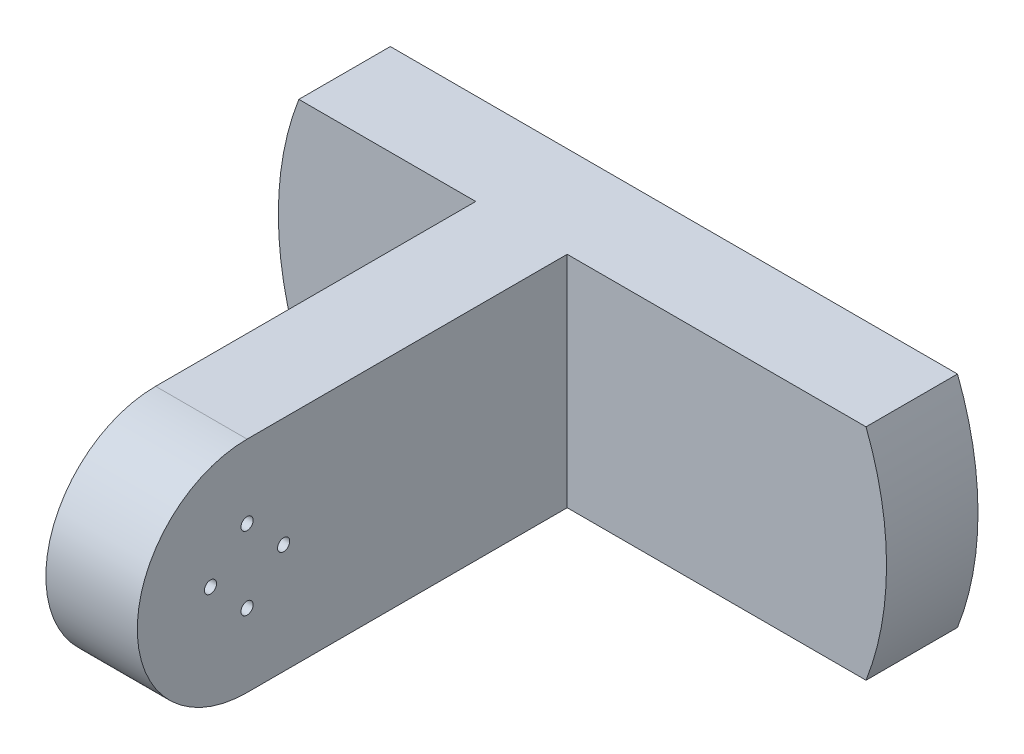
from build123d import *

# Parameters (mm, degrees)
SKETCH_2_W           = 99.74
SKETCH_2_H           = 36
EXTRUDE_1_DEPTH      = 15
SKETCH_3_R           = 1
CUT_EXTRUDE_1_DEPTH  = 5
CUT_EXTRUDE_2_REACH  = 60.24
EXTRUDE_2_DEPTH      = 7.5
EXTRUDE_2_DEPTH_BACK = 7.5
CUT_EXTRUDE_3_DEPTH  = 10
SKETCH_7_R           = 1
CUT_EXTRUDE_4_DEPTH  = 5


with BuildPart() as part:
    # 草图2 → 凸台-拉伸1 (new body)
    with BuildSketch(Plane.XY):
        with Locations((2.241740979, -3.243503904)):
            Rectangle(SKETCH_2_W, SKETCH_2_H)
    extrude(amount=EXTRUDE_1_DEPTH)

    # 草图3 → 切除-拉伸1 (cut)
    with BuildSketch(Plane.XY):
        with Locations((-40.628259021, -3.243503904)):
            Circle(SKETCH_3_R)
        with Locations((43.0931412, 9.756496096)):
            Circle(SKETCH_3_R)
        with Locations((43.0931412, -16.243503904)):
            Circle(SKETCH_3_R)
        with Locations((45.111740979, -3.243503904)):
            Circle(SKETCH_3_R)
        with Locations((-38.609659242, -16.243503904)):
            Circle(SKETCH_3_R)
        with Locations((-38.609659242, 9.756496096)):
            Circle(SKETCH_3_R)
    extrude(amount=CUT_EXTRUDE_1_DEPTH, mode=Mode.SUBTRACT)

    # 草图4 → 切除-拉伸2 (cut, up to next)
    with BuildSketch(Plane(origin=(0, 0, 0), x_dir=(-1, 0, 0), z_dir=(0, 0, -1)), mode=Mode.PRIVATE) as cut_extrude_2_sk1:
        with BuildLine():
            ThreePointArc((-52.111740979, -3.243503904), (-51.264098651, 5.912114498), (-48.749986485, 14.756496096))
            Line((-48.749986485, 14.756496096), (-52.111740979, 14.756496096))
            Line((-52.111740979, 14.756496096), (-52.111740979, -3.243503904))
        make_face()
    cut_extrude_2_tool1 = extrude(cut_extrude_2_sk1.sketch, amount=-CUT_EXTRUDE_2_REACH, mode=Mode.PRIVATE) & part.part
    # 草图4 → 切除-拉伸2 (cut, up to next)
    with BuildSketch(Plane(origin=(0, 0, 0), x_dir=(-1, 0, 0), z_dir=(0, 0, -1)), mode=Mode.PRIVATE) as cut_extrude_2_sk2:
        with BuildLine():
            Line((47.628259021, 14.756496096), (44.266504526, 14.756496096))
            ThreePointArc((44.266504526, 14.756496096), (46.780616692, 5.912114498), (47.628259021, -3.243503904))
            Line((47.628259021, -3.243503904), (47.628259021, 14.756496096))
        make_face()
    cut_extrude_2_tool2 = extrude(cut_extrude_2_sk2.sketch, amount=-CUT_EXTRUDE_2_REACH, mode=Mode.PRIVATE) & part.part
    # 草图4 → 切除-拉伸2 (cut, up to next)
    with BuildSketch(Plane(origin=(0, 0, 0), x_dir=(-1, 0, 0), z_dir=(0, 0, -1)), mode=Mode.PRIVATE) as cut_extrude_2_sk3:
        with BuildLine():
            ThreePointArc((-48.749986485, -21.243503904), (-51.264098651, -12.399122306), (-52.111740979, -3.243503904))
            Line((-52.111740979, -3.243503904), (-52.111740979, -21.243503904))
            Line((-52.111740979, -21.243503904), (-48.749986485, -21.243503904))
        make_face()
    cut_extrude_2_tool3 = extrude(cut_extrude_2_sk3.sketch, amount=-CUT_EXTRUDE_2_REACH, mode=Mode.PRIVATE) & part.part
    # 草图4 → 切除-拉伸2 (cut, up to next)
    with BuildSketch(Plane(origin=(0, 0, 0), x_dir=(-1, 0, 0), z_dir=(0, 0, -1)), mode=Mode.PRIVATE) as cut_extrude_2_sk4:
        with BuildLine():
            Line((47.628259021, -21.243503904), (47.628259021, -3.243503904))
            ThreePointArc((47.628259021, -3.243503904), (46.780616692, -12.399122306), (44.266504526, -21.243503904))
            Line((44.266504526, -21.243503904), (47.628259021, -21.243503904))
        make_face()
    cut_extrude_2_tool4 = extrude(cut_extrude_2_sk4.sketch, amount=-CUT_EXTRUDE_2_REACH, mode=Mode.PRIVATE) & part.part
    add(cut_extrude_2_tool1.solids().sort_by_distance((51.109322, 10.28739, 0))[0], mode=Mode.SUBTRACT)
    add(cut_extrude_2_tool2.solids().sort_by_distance((-46.62584, 10.28739, 0))[0], mode=Mode.SUBTRACT)
    add(cut_extrude_2_tool3.solids().sort_by_distance((51.109322, -16.774398, 0))[0], mode=Mode.SUBTRACT)
    add(cut_extrude_2_tool4.solids().sort_by_distance((-46.62584, -16.774398, 0))[0], mode=Mode.SUBTRACT)

    # 草图5 → 凸台-拉伸2 (add, two sides: drawn at the far end of the back side and taken through both)
    with BuildSketch(Plane(origin=(-7.758259021, -3.243503904, 0), x_dir=(0, 0, -1), z_dir=(1, 0, 0)).offset(-EXTRUDE_2_DEPTH_BACK)):
        with BuildLine():
            Line((-67.5, -18), (-15, -18))
            Line((-15, -18), (-15, 18))
            Line((-15, 18), (-67.5, 18))
            ThreePointArc((-67.5, 18), (-85.5, 0), (-67.5, -18))
        make_face()
    extrude(amount=EXTRUDE_2_DEPTH + EXTRUDE_2_DEPTH_BACK)

    # 草图6 → 切除-拉伸3 (cut)
    with BuildSketch(Plane.ZY.offset(15.258259021)):
        Polygon((76.160254038, 1.756496096), (67.5, 6.756496096), (58.839745962, 1.756496096), (58.839745962, -8.243503904), (67.5, -13.243503904), (76.160254038, -8.243503904), align=None)
    extrude(amount=-CUT_EXTRUDE_3_DEPTH, mode=Mode.SUBTRACT)

    # 草图7 → 切除-拉伸4 (cut)
    with BuildSketch(Plane.ZY.offset(5.258259021)):
        with Locations((67.5, 2.756496096)):
            Circle(SKETCH_7_R)
        with Locations((73.5, -3.243503904)):
            Circle(SKETCH_7_R)
        with Locations((61.5, -3.243503904)):
            Circle(SKETCH_7_R)
        with Locations((67.5, -9.243503904)):
            Circle(SKETCH_7_R)
    extrude(amount=-CUT_EXTRUDE_4_DEPTH, mode=Mode.SUBTRACT)


solid = part.part
